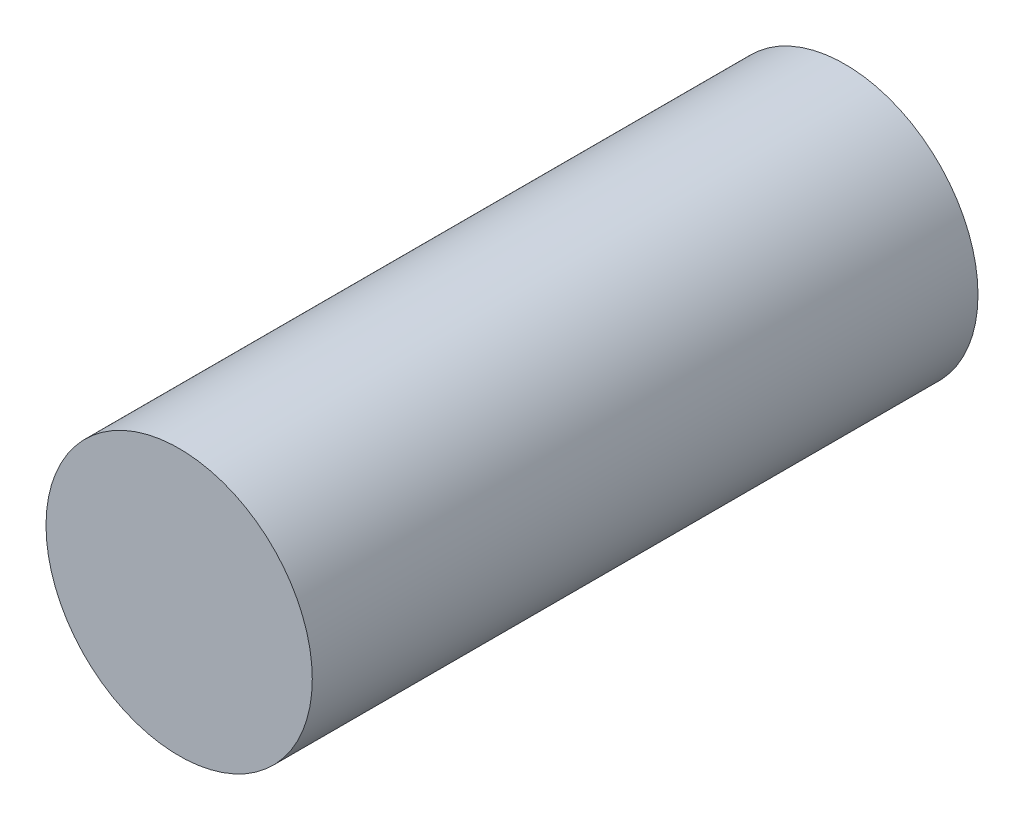
from build123d import *

# Parameters (mm, degrees)
SKETCH_1_R      = 30
EXTRUDE_1_DEPTH = 150


with BuildPart() as part:
    # 草图1 → 凸台-拉伸1 (new body)
    with BuildSketch(Plane.XY):
        Circle(SKETCH_1_R)
    extrude(amount=EXTRUDE_1_DEPTH)


solid = part.part
